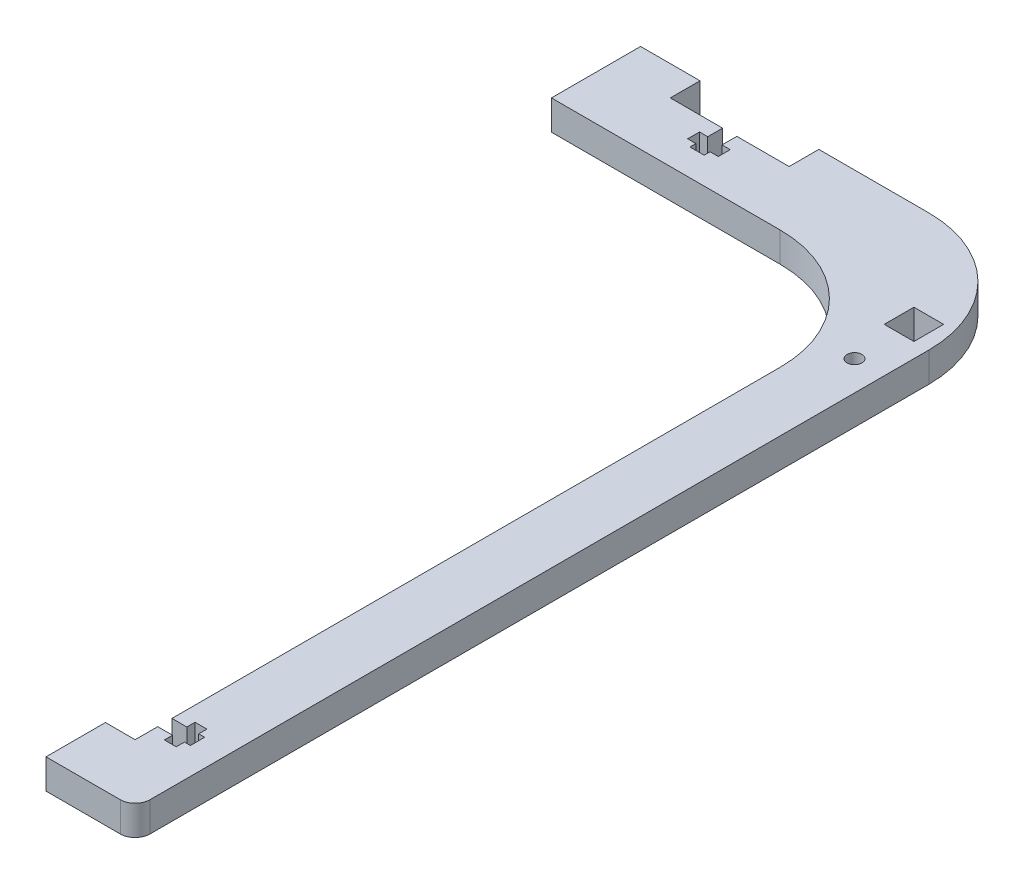
from build123d import *

# Parameters (mm, degrees)
SKETCH1_R           = 1.5875
BOSS_EXTRUDE1_DEPTH = 6.35


with BuildPart() as part:
    # Sketch1 → Boss-Extrude1 (new body)
    with BuildSketch(Plane(origin=(0, 0, 0), x_dir=(1, 0, 0), z_dir=(0, 1, 0))):
        with BuildLine():
            Line((7.882687692, 29.208698466), (-41.012312308, 29.208698466))
            Line((-41.012312308, 29.208698466), (-41.012312308, 48.258698466))
            Line((-41.012312308, 48.258698466), (-28.312312308, 48.258698466))
            Line((-28.312312308, 48.258698466), (-28.312312308, 41.908698466))
            Line((-28.312312308, 41.908698466), (-17.136241986, 41.908698466))
            Line((-17.136241986, 41.908698466), (-17.136241986, 38.733698466))
            Line((-17.136241986, 38.733698466), (-18.888841986, 38.733698466))
            Line((-18.888841986, 38.733698466), (-18.888841986, 36.193698466))
            Line((-18.888841986, 36.193698466), (-17.136241986, 36.193698466))
            Line((-17.136241986, 36.193698466), (-17.136241986, 34.923698466))
            Line((-17.136241986, 34.923698466), (-14.08838263, 34.923698466))
            Line((-14.08838263, 34.923698466), (-14.08838263, 36.193698466))
            Line((-14.08838263, 36.193698466), (-12.33578263, 36.193698466))
            Line((-12.33578263, 36.193698466), (-12.33578263, 38.733698466))
            Line((-12.33578263, 38.733698466), (-14.08838263, 38.733698466))
            Line((-14.08838263, 38.733698466), (-14.08838263, 41.908698466))
            Line((-14.08838263, 41.908698466), (-2.912312308, 41.908698466))
            Line((-2.912312308, 41.908698466), (-2.912312308, 48.258698466))
            Line((-2.912312308, 48.258698466), (20.582687692, 48.258698466))
            ThreePointArc((20.582687692, 48.258698466), (38.543199934, 40.819210709), (45.982687692, 22.858698466))
            Line((45.982687692, 22.858698466), (45.982687692, -143.587501534))
            ThreePointArc((45.982687692, -143.587501534), (45.052751722, -145.832565564), (42.807687692, -146.762501534))
            Line((42.807687692, -146.762501534), (33.282687692, -146.762501534))
            Line((33.282687692, -146.762501534), (26.932687692, -146.762501534))
            Line((26.932687692, -146.762501534), (26.932687692, -134.062501534))
            Line((26.932687692, -134.062501534), (33.282687692, -134.062501534))
            Line((33.282687692, -134.062501534), (33.282687692, -129.236431212))
            Line((33.282687692, -129.236431212), (36.457687692, -129.236431212))
            Line((36.457687692, -129.236431212), (36.457687692, -130.989031212))
            Line((36.457687692, -130.989031212), (38.997687692, -130.989031212))
            Line((38.997687692, -130.989031212), (38.997687692, -129.236431212))
            Line((38.997687692, -129.236431212), (40.267687692, -129.236431212))
            Line((40.267687692, -129.236431212), (40.267687692, -126.188571855))
            Line((40.267687692, -126.188571855), (38.997687692, -126.188571855))
            Line((38.997687692, -126.188571855), (38.997687692, -124.435971855))
            Line((38.997687692, -124.435971855), (36.457687692, -124.435971855))
            Line((36.457687692, -124.435971855), (36.457687692, -126.188571855))
            Line((36.457687692, -126.188571855), (33.282687692, -126.188571855))
            Line((33.282687692, -126.188571855), (33.282687692, -121.362501534))
            Line((33.282687692, -121.362501534), (33.282687692, 3.808698466))
            ThreePointArc((33.282687692, 3.808698466), (25.843199934, 21.769210709), (7.882687692, 29.208698466))
        make_face()
        with Locations(Location((39.632687692, 13.333698466, 0), (0, 0, 270))):
            Circle(SKETCH1_R, mode=Mode.SUBTRACT)
        Polygon((39.632687692, 29.208698466), (42.807687692, 29.208698466), (42.807687692, 22.858698466), (36.457687692, 22.858698466), (36.457687692, 29.208698466), align=None, mode=Mode.SUBTRACT)
    extrude(amount=BOSS_EXTRUDE1_DEPTH)


solid = part.part
